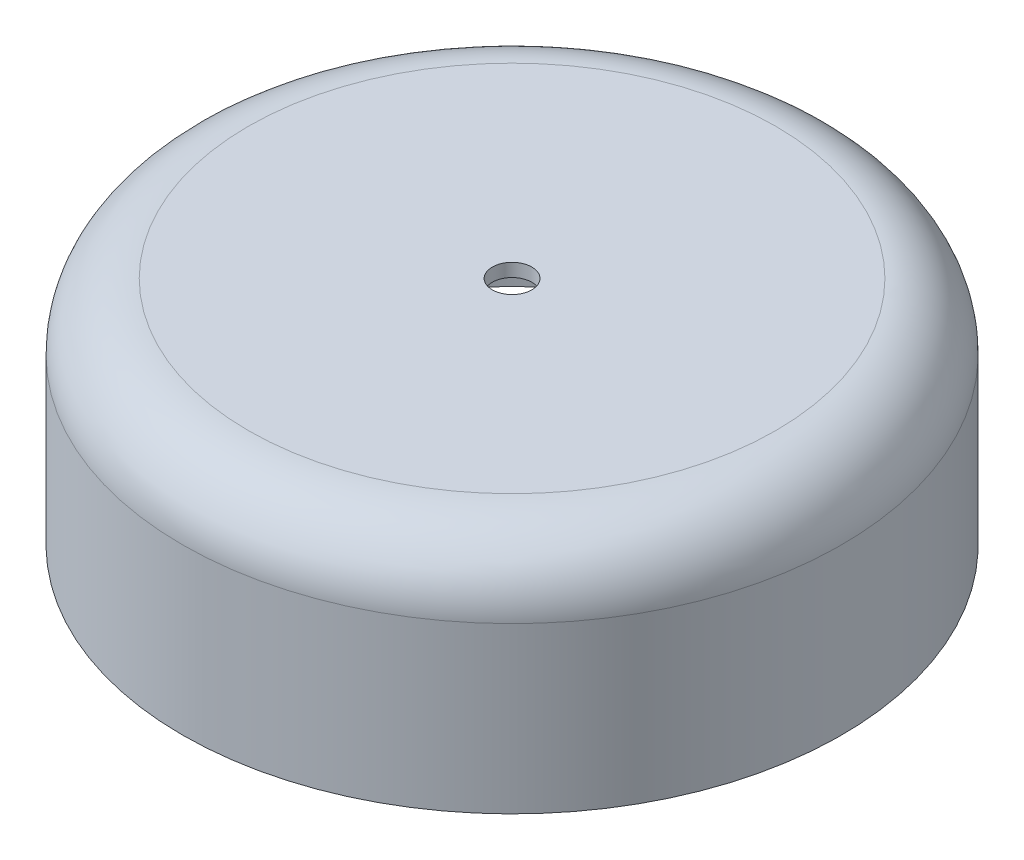
from build123d import *

# Parameters (mm, degrees)
SKETCH1_R           = 50
BOSS_EXTRUDE1_DEPTH = 35
FILLET1_R           = 10
SHELL1_T            = -2
SKETCH2_W           = 12
SKETCH2_H           = 4.5
BOSS_EXTRUDE2_DEPTH = 6.5
SKETCH3_R           = 3
CUT_EXTRUDE1_DEPTH  = 84.854384387


with BuildPart() as part:
    # Sketch1 → Boss-Extrude1 (new body)
    with BuildSketch(Plane(origin=(0, 0, 0), x_dir=(1, 0, 0), z_dir=(0, 1, 0))):
        with Locations(Location((0, 7.502676293, 0), (0, 0, 270))):
            Circle(SKETCH1_R)
    extrude(amount=BOSS_EXTRUDE1_DEPTH)

    # Fillet1
    fillet1_edges = [part.edges().sort_by_distance(p)[0] for p in [
        (0, 35, -57.502676293),
    ]]
    fillet(fillet1_edges, radius=FILLET1_R)

    # Shell1
    shell1_openings = [part.faces().sort_by_distance(p)[0] for p in [
        (0, 0, -7.502676293),
    ]]
    offset(amount=SHELL1_T, openings=shell1_openings, kind=Kind.INTERSECTION)

    # Sketch2 → Boss-Extrude2 (add)
    with BuildSketch(Plane(origin=(0, 33, 0), x_dir=(-1, 0, 0), z_dir=(0, -1, 0))):
        with Locations((0, -8.25)):
            Rectangle(SKETCH2_W, SKETCH2_H)
        with Locations((0, 19.25)):
            Rectangle(SKETCH2_W, SKETCH2_H)
    extrude(amount=BOSS_EXTRUDE2_DEPTH)

    # Sketch3 → Cut-Extrude1 (cut, through all)
    with BuildSketch(Plane(origin=(0, 35, 0), x_dir=(1, 0, 0), z_dir=(0, 1, 0))):
        with Locations(Location((0, 7.502676293, 0), (0, 0, 270))):
            Circle(SKETCH3_R)
    extrude(amount=-CUT_EXTRUDE1_DEPTH, mode=Mode.SUBTRACT)


solid = part.part
